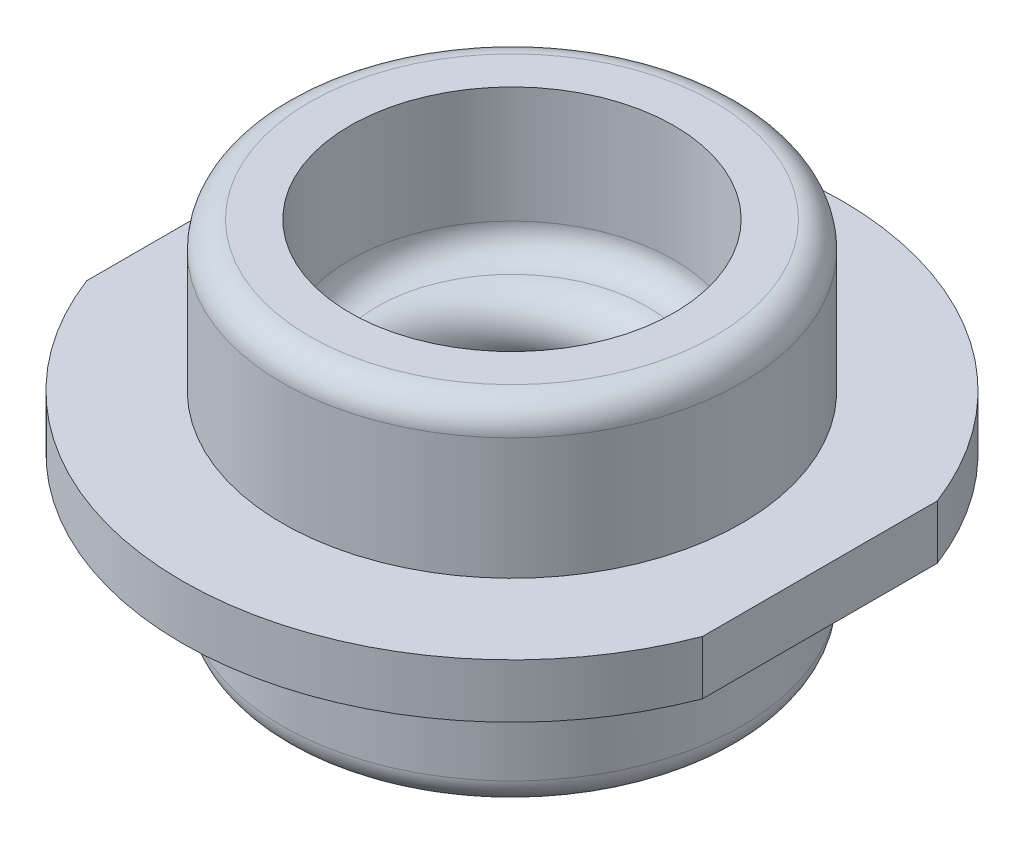
from build123d import *

# Parameters (mm, degrees)
FILLET1_R          = 0.127
SKETCH2_W          = 1.656655401
SKETCH2_H          = 3.010652604
CUT_EXTRUDE1_DEPTH = 1.27


with BuildPart() as part:
    # Sketch1 → Revolve1 (revolve)
    with BuildSketch(Plane.XY, mode=Mode.PRIVATE) as revolve1_sk:
        with BuildLine():
            Line((-1.0795, 0.8255), (-1.0795, 0.127))
            Line((-1.0795, 0.127), (-1.5494, 0.127))
            Line((-1.5494, 0.127), (-1.5494, -0.127))
            Line((-1.5494, -0.127), (-1.0795, -0.127))
            Line((-1.0795, -0.127), (-1.0795, -0.8255))
            Line((-1.0795, -0.8255), (-0.762, -0.8255))
            Line((-0.762, -0.8255), (-0.762, -0.2794))
            ThreePointArc((-0.762, -0.2794), (-0.724802561, -0.189597439), (-0.635, -0.1524))
            ThreePointArc((-0.635, -0.1524), (-0.527236927, -0.107763073), (-0.4826, 0))
            ThreePointArc((-0.4826, 0), (-0.527236927, 0.107763073), (-0.635, 0.1524))
            ThreePointArc((-0.635, 0.1524), (-0.724802561, 0.189597439), (-0.762, 0.2794))
            Line((-0.762, 0.2794), (-0.762, 0.8255))
            Line((-0.762, 0.8255), (-1.0795, 0.8255))
        make_face()
    revolve(revolve1_sk.sketch.rotate(Axis((0, 0, 0), (0, 1, 0)), 270), axis=Axis((0, 0, 0), (0, 1, 0)))

    # Fillet1
    fillet1_edges = [part.edges().sort_by_distance(p)[0] for p in [
        (0, -0.8255, 1.0795),
        (0, 0.8255, 1.0795),
    ]]
    fillet(fillet1_edges, radius=FILLET1_R)

    # Sketch2 → Cut-Extrude1 (cut, symmetric)
    with BuildSketch(Plane(origin=(0, 0, 0), x_dir=(1, 0, 0), z_dir=(0, 1, 0))):
        with Locations((-2.276127701, -0.051770481)):
            Rectangle(SKETCH2_W, SKETCH2_H)
        with Locations((2.276127701, -0.051770481)):
            Rectangle(SKETCH2_W, SKETCH2_H)
    extrude(amount=CUT_EXTRUDE1_DEPTH, both=True, mode=Mode.SUBTRACT)


solid = part.part
